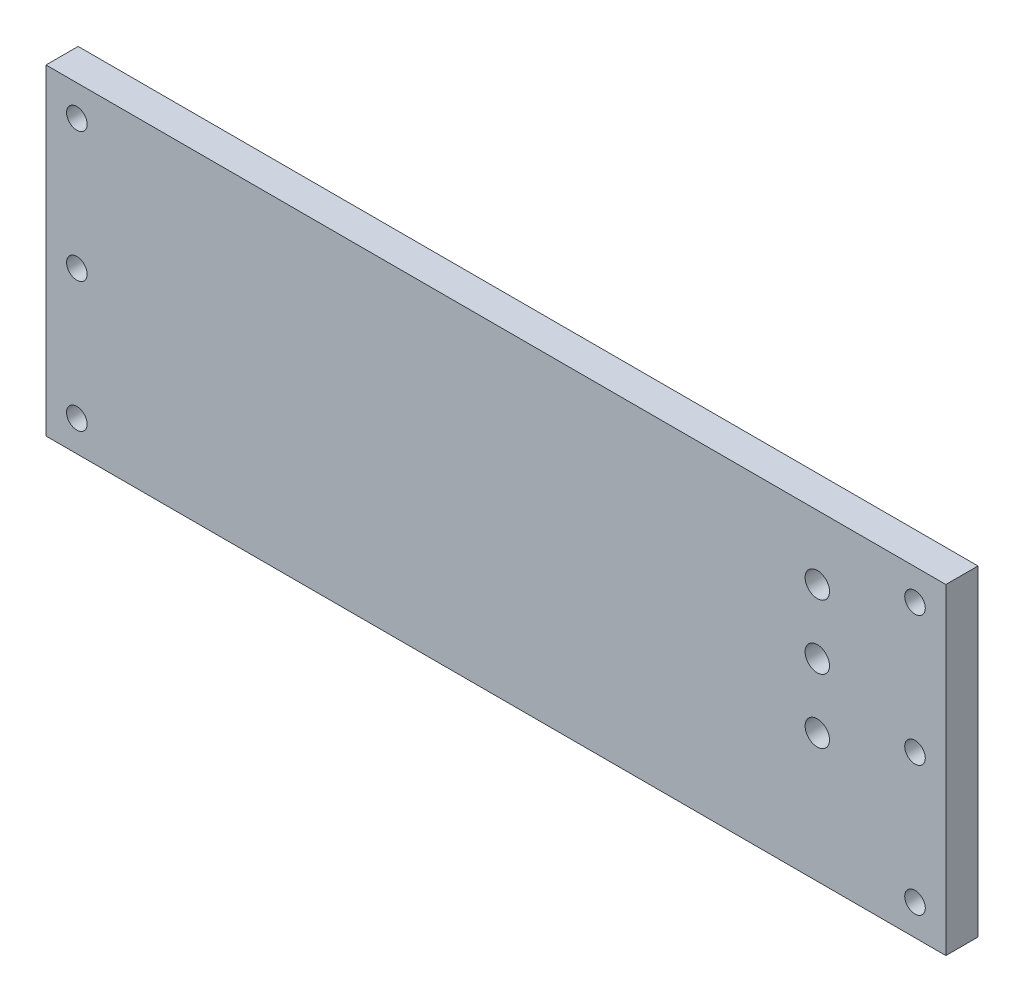
from build123d import *

# Parameters (mm, degrees)
SKETCH1_W           = 177.8
SKETCH1_H           = 63.5
SKETCH1_R           = 2.032
BOSS_EXTRUDE1_DEPTH = 6.35
SKETCH2_R           = 2.413
CUT_EXTRUDE1_DEPTH  = 6.35
LPATTERN1_COUNT     = 3
LPATTERN1_PITCH     = 12.7


with BuildPart() as part:
    # Sketch1 → Boss-Extrude1 (new body)
    with BuildSketch(Plane.XY):
        Rectangle(SKETCH1_W, SKETCH1_H)
        with Locations((-82.804, 25.654)):
            Circle(SKETCH1_R, mode=Mode.SUBTRACT)
        with Locations((-82.804, 0)):
            Circle(SKETCH1_R, mode=Mode.SUBTRACT)
        with Locations((-82.804, -25.654)):
            Circle(SKETCH1_R, mode=Mode.SUBTRACT)
        with Locations((82.804, -25.654)):
            Circle(SKETCH1_R, mode=Mode.SUBTRACT)
        with Locations((82.804, 0)):
            Circle(SKETCH1_R, mode=Mode.SUBTRACT)
        with Locations((82.804, 25.654)):
            Circle(SKETCH1_R, mode=Mode.SUBTRACT)
    extrude(amount=BOSS_EXTRUDE1_DEPTH)

    # Sketch2 → Cut-Extrude1 (cut)
    with BuildSketch(Plane.XY.offset(6.35)):
        with Locations((63.5, 19.05)):
            Circle(SKETCH2_R)
    cut_extrude1 = extrude(amount=-CUT_EXTRUDE1_DEPTH, mode=Mode.SUBTRACT)

    # LPattern1: Cut-Extrude1 ×3
    with Locations(*[(0, -i * LPATTERN1_PITCH, 0) for i in range(1, LPATTERN1_COUNT)]):
        add(cut_extrude1, mode=Mode.SUBTRACT)


solid = part.part
